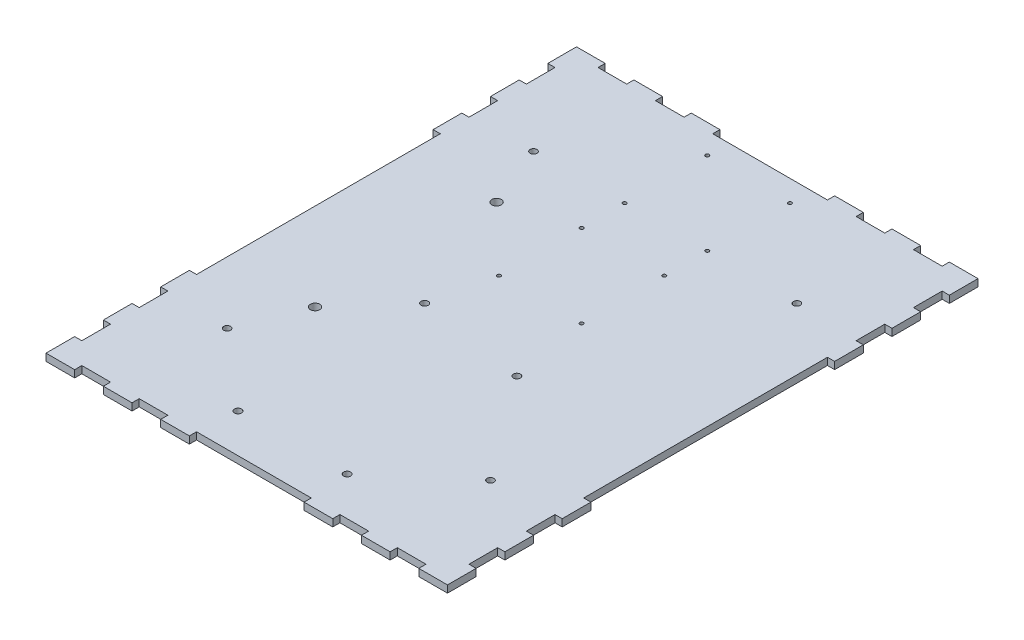
from build123d import *

# Parameters (mm, degrees)
BOSS_EXTRUDE1_DEPTH     = 3.175
CUT_EXTRUDE1_DEPTH      = 295.659843082
CUT_EXTRUDE1_DEPTH_BACK = 3.175
SKETCH2_R               = 1.524
SKETCH3_R               = 0.8
CUT_EXTRUDE2_DEPTH      = 5.715
SKETCH4_R               = 1.5621
CUT_EXTRUDE3_DEPTH      = 10.16
SKETCH5_W               = 50.8
SKETCH5_H               = 3.175
SKETCH5_W_2             = 12.7
CUT_EXTRUDE4_DEPTH      = 7.62
SKETCH7_R               = 2.0955
CUT_EXTRUDE5_DEPTH      = 7.62


with BuildPart() as part:
    # Sketch1 → Boss-Extrude1 (new body)
    with BuildSketch(Plane(origin=(0, 0, 0), x_dir=(1, 0, 0), z_dir=(0, 1, 0))):
        Polygon((3.175, 209.55), (0, 209.55), (0, 196.85), (3.175, 196.85), (3.175, 184.15), (0, 184.15), (0, 171.45), (3.175, 171.45), (3.175, 63.5), (0, 63.5), (0, 50.8), (3.175, 50.8), (3.175, 38.1), (0, 38.1), (0, 25.4), (3.175, 25.4), (3.175, 12.7), (0, 12.7), (0, 0), (177.8, 0), (177.8, 12.7), (174.625, 12.7), (174.625, 25.4), (177.8, 25.4), (177.8, 38.1), (174.625, 38.1), (174.625, 50.8), (177.8, 50.8), (177.8, 63.5), (174.625, 63.5), (174.625, 171.45), (177.8, 171.45), (177.8, 184.15), (174.625, 184.15), (174.625, 196.85), (177.8, 196.85), (177.8, 209.55), (174.625, 209.55), (174.625, 222.25), (177.8, 222.25), (177.8, 234.95), (0, 234.95), (0, 222.25), (3.175, 222.25), align=None)
    extrude(amount=BOSS_EXTRUDE1_DEPTH)

    # Sketch2 → Cut-Extrude1 (cut, two sides: drawn at the far end of the back side and taken through both)
    with BuildSketch(Plane(origin=(0, 3.175, 0), x_dir=(1, 0, 0), z_dir=(0, 1, 0)).offset(-CUT_EXTRUDE1_DEPTH_BACK)):
        with Locations((30.5816, 49.6316)):
            Circle(SKETCH2_R)
        with Locations((30.5816, 185.3184)):
            Circle(SKETCH2_R)
        with Locations((147.2184, 49.6316)):
            Circle(SKETCH2_R)
        with Locations((147.2184, 185.3184)):
            Circle(SKETCH2_R)
    extrude(amount=CUT_EXTRUDE1_DEPTH + CUT_EXTRUDE1_DEPTH_BACK, mode=Mode.SUBTRACT)

    # Sketch3 → Cut-Extrude2 (cut)
    with BuildSketch(Plane(origin=(0, 3.175, 0), x_dir=(1, 0, 0), z_dir=(0, 1, 0))):
        with Locations((70.6, 222.25)):
            Circle(SKETCH3_R)
        with Locations((107.2, 222.25)):
            Circle(SKETCH3_R)
        with Locations((70.6, 185.65)):
            Circle(SKETCH3_R)
        with Locations((107.2, 185.65)):
            Circle(SKETCH3_R)
        with Locations((70.6, 166.6)):
            Circle(SKETCH3_R)
        with Locations((107.2, 166.6)):
            Circle(SKETCH3_R)
        with Locations((70.6, 130)):
            Circle(SKETCH3_R)
        with Locations((107.2, 130)):
            Circle(SKETCH3_R)
    extrude(amount=-CUT_EXTRUDE2_DEPTH, mode=Mode.SUBTRACT)

    # Sketch4 → Cut-Extrude3 (cut)
    with BuildSketch(Plane(origin=(0, 3.175, 0), x_dir=(1, 0, 0), z_dir=(0, 1, 0))):
        with Locations((64.7319, 20.32)):
            Circle(SKETCH4_R)
        with Locations((113.0681, 20.32)):
            Circle(SKETCH4_R)
        with Locations((64.7319, 102.9462)):
            Circle(SKETCH4_R)
        with Locations((113.0681, 95.4532)):
            Circle(SKETCH4_R)
    extrude(amount=-CUT_EXTRUDE3_DEPTH, mode=Mode.SUBTRACT)

    # Sketch5 → Cut-Extrude4 (cut)
    with BuildSketch(Plane(origin=(0, 3.175, 0), x_dir=(1, 0, 0), z_dir=(0, 1, 0))):
        with Locations((88.9, 1.5875)):
            Rectangle(SKETCH5_W, SKETCH5_H)
        with Locations((44.45, 1.5875)):
            Rectangle(SKETCH5_W_2, SKETCH5_H)
        with Locations((133.35, 1.5875)):
            Rectangle(SKETCH5_W_2, SKETCH5_H)
        with Locations((19.05, 1.5875)):
            Rectangle(SKETCH5_W_2, SKETCH5_H)
        with Locations((158.75, 1.5875)):
            Rectangle(SKETCH5_W_2, SKETCH5_H)
    cut_extrude4 = extrude(amount=-CUT_EXTRUDE4_DEPTH, mode=Mode.SUBTRACT)

    # Mirror1: Cut-Extrude4 across plane
    add(cut_extrude4.mirror(Plane.XY.offset(-117.475)), mode=Mode.SUBTRACT)

    # Sketch7 → Cut-Extrude5 (cut)
    with BuildSketch(Plane.XZ):
        with Locations((41.8719, -77.2795)):
            Circle(SKETCH7_R)
        with Locations((41.8719, -157.6705)):
            Circle(SKETCH7_R)
    extrude(amount=-CUT_EXTRUDE5_DEPTH, mode=Mode.SUBTRACT)


solid = part.part
